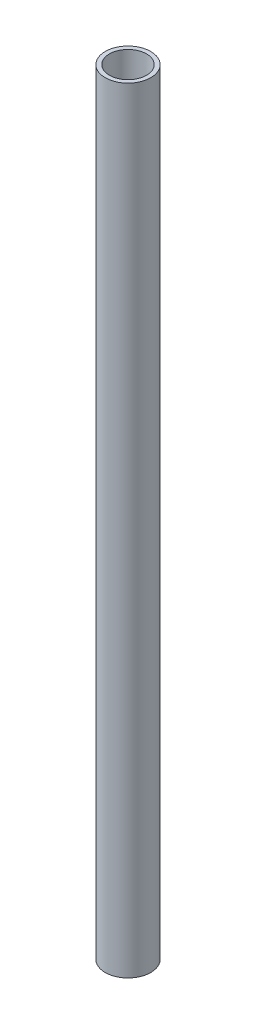
from build123d import *

# Parameters (mm, degrees)
SKETCH1_R           = 14.1
SKETCH1_R_2         = 11.5
BOSS_EXTRUDE1_DEPTH = 480.44


with BuildPart() as part:
    # Sketch1 → Boss-Extrude1 (new body)
    with BuildSketch(Plane(origin=(0, 0, 0), x_dir=(1, 0, 0), z_dir=(0, 1, 0))):
        Circle(SKETCH1_R)
        Circle(SKETCH1_R_2, mode=Mode.SUBTRACT)
    extrude(amount=BOSS_EXTRUDE1_DEPTH)


solid = part.part
